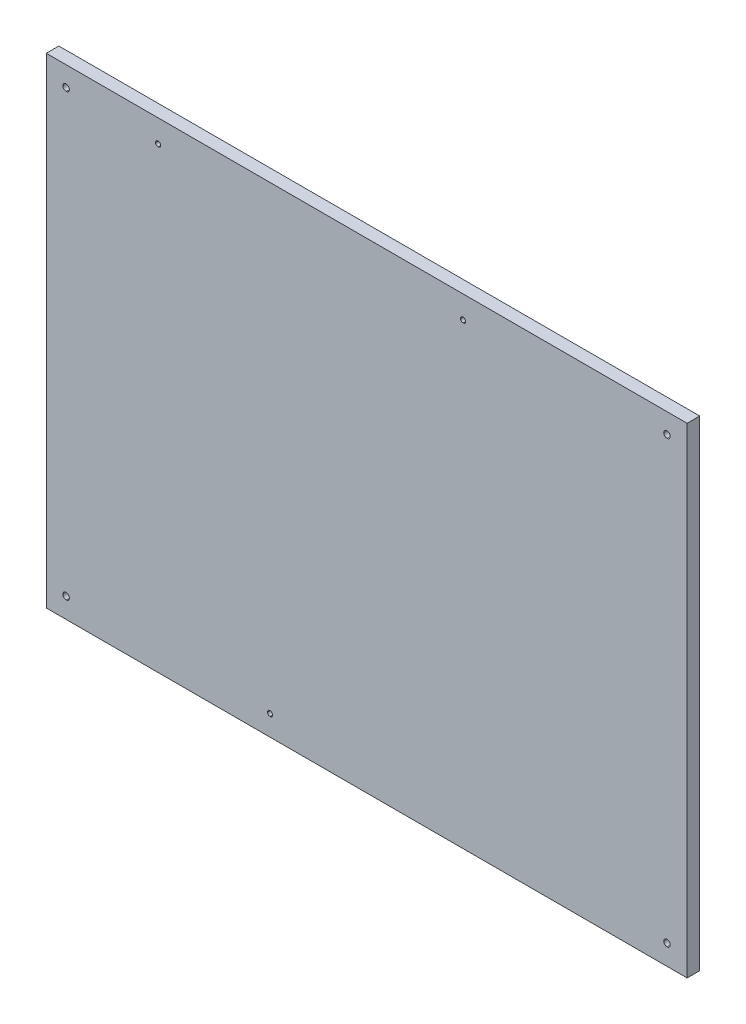
from build123d import *

# Parameters (mm, degrees)
MODEL_W             = 79.967666
MODEL_H             = 59.944
BOSS_EXTRUDE2_DEPTH = 1.57


with BuildPart() as part:
    # Model → Boss-Extrude2 (new body)
    with BuildSketch(Plane.XY):
        with Locations((98.3615, 151.75103)):
            Rectangle(MODEL_W, MODEL_H)
        with BuildLine():
            add(Edge.make_bspline(
                [(86.614, 124.31903), (86.614, 124.488363), (86.487, 124.657697), (86.317667, 124.657697)],
                knots=[0, 0, 0, 0, 1, 1, 1, 1], degree=3))
            add(Edge.make_bspline(
                [(86.317667, 124.657697), (86.106, 124.657697), (85.979, 124.488363), (85.979, 124.31903)],
                knots=[0, 0, 0, 0, 1, 1, 1, 1], degree=3))
            add(Edge.make_bspline(
                [(85.979, 124.31903), (85.979, 124.149697), (86.106, 124.022697), (86.317667, 124.022697)],
                knots=[0, 0, 0, 0, 1, 1, 1, 1], degree=3))
            add(Edge.make_bspline(
                [(86.317667, 124.022697), (86.487, 124.022697), (86.614, 124.149697), (86.614, 124.31903)],
                knots=[0, 0, 0, 0, 1, 1, 1, 1], degree=3))
        make_face(mode=Mode.SUBTRACT)
        with BuildLine():
            add(Edge.make_bspline(
                [(61.256333, 124.276697), (61.256333, 124.530697), (61.087, 124.70003), (60.875333, 124.70003)],
                knots=[0, 0, 0, 0, 1, 1, 1, 1], degree=3))
            add(Edge.make_bspline(
                [(60.875333, 124.70003), (60.621333, 124.70003), (60.452, 124.530697), (60.452, 124.276697)],
                knots=[0, 0, 0, 0, 1, 1, 1, 1], degree=3))
            add(Edge.make_bspline(
                [(60.452, 124.276697), (60.452, 124.06503), (60.621333, 123.895697), (60.875333, 123.895697)],
                knots=[0, 0, 0, 0, 1, 1, 1, 1], degree=3))
            add(Edge.make_bspline(
                [(60.875333, 123.895697), (61.087, 123.895697), (61.256333, 124.06503), (61.256333, 124.276697)],
                knots=[0, 0, 0, 0, 1, 1, 1, 1], degree=3))
        make_face(mode=Mode.SUBTRACT)
        with BuildLine():
            add(Edge.make_bspline(
                [(136.228667, 124.276697), (136.228667, 124.530697), (136.059333, 124.70003), (135.847667, 124.70003)],
                knots=[0, 0, 0, 0, 1, 1, 1, 1], degree=3))
            add(Edge.make_bspline(
                [(135.847667, 124.70003), (135.593667, 124.70003), (135.424333, 124.530697), (135.424333, 124.276697)],
                knots=[0, 0, 0, 0, 1, 1, 1, 1], degree=3))
            add(Edge.make_bspline(
                [(135.424333, 124.276697), (135.424333, 124.06503), (135.593667, 123.895697), (135.847667, 123.895697)],
                knots=[0, 0, 0, 0, 1, 1, 1, 1], degree=3))
            add(Edge.make_bspline(
                [(135.847667, 123.895697), (136.059333, 123.895697), (136.228667, 124.06503), (136.228667, 124.276697)],
                knots=[0, 0, 0, 0, 1, 1, 1, 1], degree=3))
        make_face(mode=Mode.SUBTRACT)
        with BuildLine():
            add(Edge.make_bspline(
                [(136.228667, 179.225363), (136.228667, 179.479363), (136.059333, 179.648697), (135.847667, 179.648697)],
                knots=[0, 0, 0, 0, 1, 1, 1, 1], degree=3))
            add(Edge.make_bspline(
                [(135.847667, 179.648697), (135.593667, 179.648697), (135.424333, 179.479363), (135.424333, 179.225363)],
                knots=[0, 0, 0, 0, 1, 1, 1, 1], degree=3))
            add(Edge.make_bspline(
                [(135.424333, 179.225363), (135.424333, 179.013697), (135.593667, 178.844363), (135.847667, 178.844363)],
                knots=[0, 0, 0, 0, 1, 1, 1, 1], degree=3))
            add(Edge.make_bspline(
                [(135.847667, 178.844363), (136.059333, 178.844363), (136.228667, 179.013697), (136.228667, 179.225363)],
                knots=[0, 0, 0, 0, 1, 1, 1, 1], degree=3))
        make_face(mode=Mode.SUBTRACT)
        with BuildLine():
            add(Edge.make_bspline(
                [(72.644, 178.886697), (72.644, 179.05603), (72.517, 179.225363), (72.347667, 179.225363)],
                knots=[0, 0, 0, 0, 1, 1, 1, 1], degree=3))
            add(Edge.make_bspline(
                [(72.347667, 179.225363), (72.136, 179.225363), (72.009, 179.05603), (72.009, 178.886697)],
                knots=[0, 0, 0, 0, 1, 1, 1, 1], degree=3))
            add(Edge.make_bspline(
                [(72.009, 178.886697), (72.009, 178.717363), (72.136, 178.590363), (72.347667, 178.590363)],
                knots=[0, 0, 0, 0, 1, 1, 1, 1], degree=3))
            add(Edge.make_bspline(
                [(72.347667, 178.590363), (72.517, 178.590363), (72.644, 178.717363), (72.644, 178.886697)],
                knots=[0, 0, 0, 0, 1, 1, 1, 1], degree=3))
        make_face(mode=Mode.SUBTRACT)
        with BuildLine():
            add(Edge.make_bspline(
                [(110.701667, 178.886697), (110.701667, 179.05603), (110.574667, 179.225363), (110.405333, 179.225363)],
                knots=[0, 0, 0, 0, 1, 1, 1, 1], degree=3))
            add(Edge.make_bspline(
                [(110.405333, 179.225363), (110.193667, 179.225363), (110.066667, 179.05603), (110.066667, 178.886697)],
                knots=[0, 0, 0, 0, 1, 1, 1, 1], degree=3))
            add(Edge.make_bspline(
                [(110.066667, 178.886697), (110.066667, 178.717363), (110.193667, 178.590363), (110.405333, 178.590363)],
                knots=[0, 0, 0, 0, 1, 1, 1, 1], degree=3))
            add(Edge.make_bspline(
                [(110.405333, 178.590363), (110.574667, 178.590363), (110.701667, 178.717363), (110.701667, 178.886697)],
                knots=[0, 0, 0, 0, 1, 1, 1, 1], degree=3))
        make_face(mode=Mode.SUBTRACT)
        with BuildLine():
            add(Edge.make_bspline(
                [(61.256333, 179.225363), (61.256333, 179.479363), (61.087, 179.648697), (60.875333, 179.648697)],
                knots=[0, 0, 0, 0, 1, 1, 1, 1], degree=3))
            add(Edge.make_bspline(
                [(60.875333, 179.648697), (60.621333, 179.648697), (60.452, 179.479363), (60.452, 179.225363)],
                knots=[0, 0, 0, 0, 1, 1, 1, 1], degree=3))
            add(Edge.make_bspline(
                [(60.452, 179.225363), (60.452, 179.013697), (60.621333, 178.844363), (60.875333, 178.844363)],
                knots=[0, 0, 0, 0, 1, 1, 1, 1], degree=3))
            add(Edge.make_bspline(
                [(60.875333, 178.844363), (61.087, 178.844363), (61.256333, 179.013697), (61.256333, 179.225363)],
                knots=[0, 0, 0, 0, 1, 1, 1, 1], degree=3))
        make_face(mode=Mode.SUBTRACT)
    extrude(amount=-BOSS_EXTRUDE2_DEPTH)


solid = part.part
